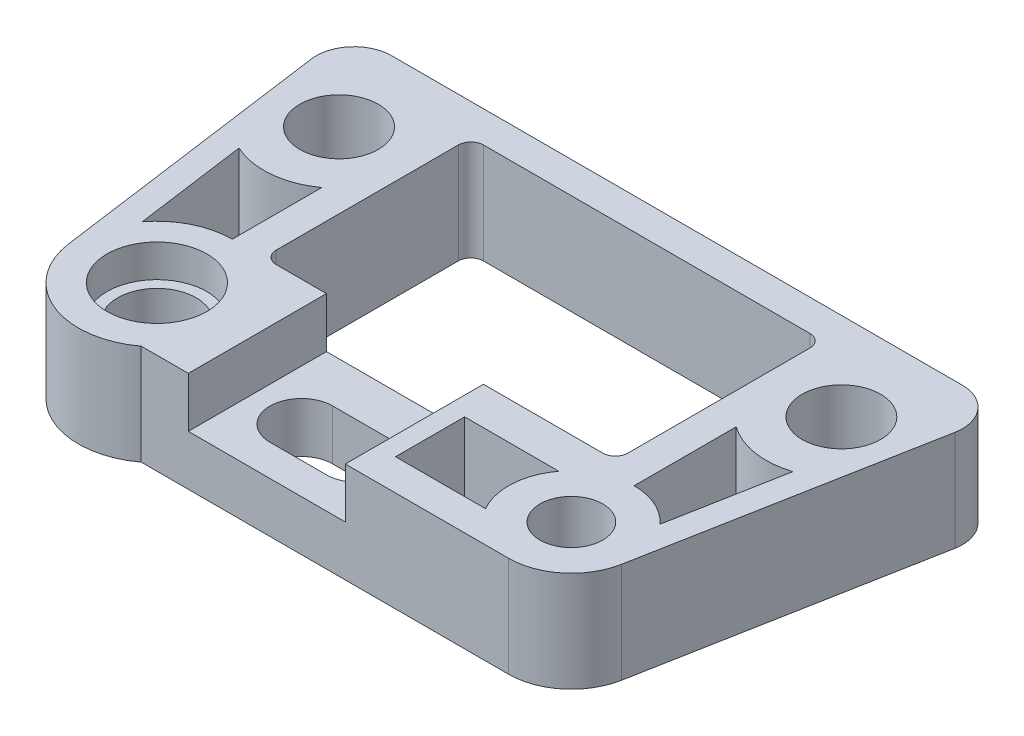
from build123d import *

# Parameters (mm, degrees)
SKETCH3_R           = 3.96875
SKETCH3_R_2         = 3.175
BOSS_EXTRUDE4_DEPTH = 10.16
SKETCH5_W           = 15.875
SKETCH5_H           = 13.97
CUT_EXTRUDE3_DEPTH  = 5.08
FILLET1_R           = 3.81
SKETCH6_R           = 5.05
CUT_EXTRUDE4_DEPTH  = 3.3


with BuildPart() as part:
    # Sketch3 → Boss-Extrude4 (new body)
    with BuildSketch(Plane(origin=(0, 0, 0), x_dir=(1, 0, 0), z_dir=(0, 1, 0))):
        with BuildLine():
            Line((54.2925, 31.75), (-12.3825, 31.75))
            Line((-12.3825, 31.75), (-7.863361559, -1.082336008))
            ThreePointArc((-7.863361559, -1.082336008), (-3.056289676, -7.325503373), (4.7625, -6.35))
            Line((4.7625, -6.35), (41.91, -6.35))
            ThreePointArc((41.91, -6.35), (45.967580476, -4.884520517), (48.152310263, -1.164501002))
            Line((48.152310263, -1.164501002), (54.2925, 31.75))
        make_face()
        with Locations(Location((0, 0, 0), (0, 0, 270))):
            Circle(SKETCH3_R, mode=Mode.SUBTRACT)
        with Locations(Location((-4.445, 22.86, 0), (0, 0, 270))):
            Circle(SKETCH3_R, mode=Mode.SUBTRACT)
        with Locations(Location((46.355, 22.86, 0), (0, 0, 270))):
            Circle(SKETCH3_R, mode=Mode.SUBTRACT)
        with Locations(Location((41.91, 0, 0), (0, 0, 270))):
            Circle(SKETCH3_R_2, mode=Mode.SUBTRACT)
        with BuildLine():
            Line((38.735, 8.89), (38.735, 27.305))
            ThreePointArc((38.735, 27.305), (38.363025612, 28.203025612), (37.465, 28.575))
            Line((37.465, 28.575), (4.445, 28.575))
            ThreePointArc((4.445, 28.575), (3.546974388, 28.203025612), (3.175, 27.305))
            Line((3.175, 27.305), (3.175, 8.89))
            ThreePointArc((3.175, 8.89), (3.546974388, 7.991974388), (4.445, 7.62))
            Line((4.445, 7.62), (37.465, 7.62))
            ThreePointArc((37.465, 7.62), (38.363025612, 7.991974388), (38.735, 8.89))
        make_face(mode=Mode.SUBTRACT)
        with BuildLine():
            Line((20.32, 3.175), (14.605, 3.175))
            ThreePointArc((14.605, 3.175), (11.43, 0), (14.605, -3.175))
            Line((14.605, -3.175), (20.32, -3.175))
            ThreePointArc((20.32, -3.175), (22.498043553, -2.310140965), (23.489504023, -0.186733089))
            Line((23.489504023, -0.186733089), (21.228562514, 3.04222602))
            ThreePointArc((21.228562514, 3.04222602), (20.779106407, 3.141631154), (20.32, 3.175))
        make_face(mode=Mode.SUBTRACT)
        with BuildLine():
            Line((46.58698696, 4.295147609), (48.697586564, 15.60902157))
            ThreePointArc((48.697586564, 15.60902157), (45.177345011, 15.331552037), (41.91, 16.670785591))
            Line((41.91, 16.670785591), (41.91, 6.35))
            ThreePointArc((41.91, 6.35), (44.464242812, 5.81363429), (46.58698696, 4.295147609))
        make_face(mode=Mode.SUBTRACT)
        with BuildLine():
            Line((-6.080523252, 4.592563226), (-7.642900683, 15.943510195))
            ThreePointArc((-7.642900683, 15.943510195), (-3.723164456, 15.274266453), (0, 16.670785591))
            Line((0, 16.670785591), (0, 7.62))
            ThreePointArc((0, 7.62), (-3.396252951, 6.82128037), (-6.080523252, 4.592563226))
        make_face(mode=Mode.SUBTRACT)
        with BuildLine():
            Line((36.410738686, -3.175), (27.305, -3.175))
            Line((27.305, -3.175), (27.305, 3.81))
            Line((27.305, 3.81), (36.83, 3.81))
            ThreePointArc((36.83, 3.81), (35.571407985, 0.380461907), (36.410738686, -3.175))
        make_face(mode=Mode.SUBTRACT)
    extrude(amount=BOSS_EXTRUDE4_DEPTH)

    # Sketch5 → Cut-Extrude3 (cut)
    with BuildSketch(Plane(origin=(0, 10.16, 0), x_dir=(1, 0, 0), z_dir=(0, 1, 0))):
        with Locations((17.4625, 0.635)):
            Rectangle(SKETCH5_W, SKETCH5_H)
    extrude(amount=-CUT_EXTRUDE3_DEPTH, mode=Mode.SUBTRACT)

    # Fillet1
    fillet1_edges = [part.edges().sort_by_distance(p)[0] for p in [
        (-12.3825, 5.08, -31.75),
        (54.2925, 5.08, -31.75),
    ]]
    fillet(fillet1_edges, radius=FILLET1_R)

    # Sketch6 → Cut-Extrude4 (cut)
    with BuildSketch(Plane(origin=(0, 10.16, 0), x_dir=(1, 0, 0), z_dir=(0, 1, 0))):
        with Locations(Location((0, 0, 0), (0, 0, 270))):
            Circle(SKETCH6_R)
    extrude(amount=-CUT_EXTRUDE4_DEPTH, mode=Mode.SUBTRACT)


solid = part.part
